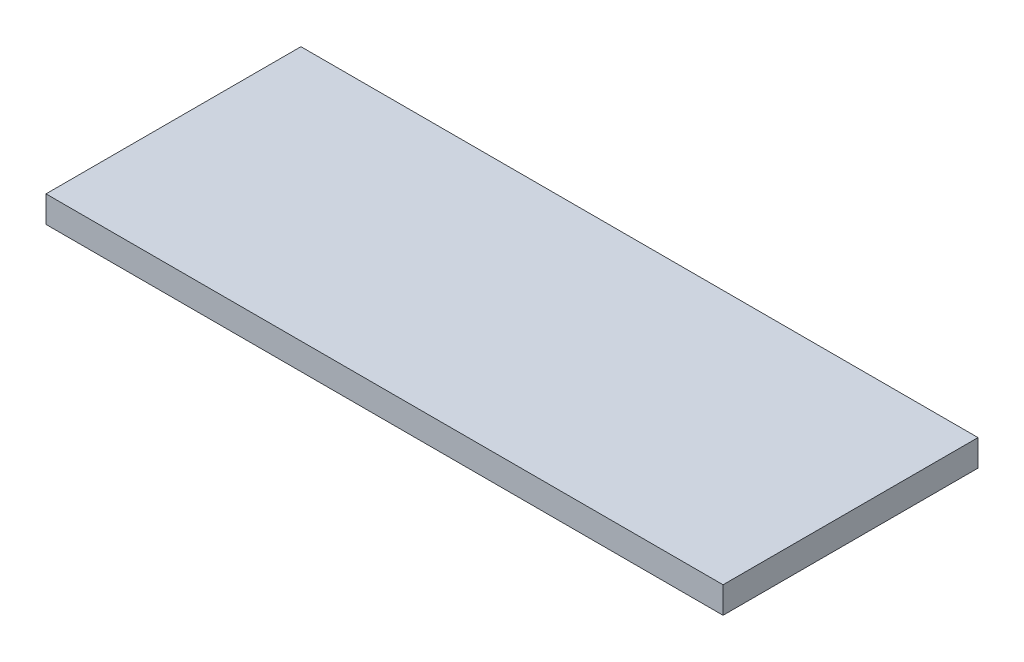
from build123d import *

# Parameters (mm, degrees)
SKETCH1_W           = 40.9
SKETCH1_H           = 15.4
BOSS_EXTRUDE1_DEPTH = 1.6


with BuildPart() as part:
    # Sketch1 → Boss-Extrude1 (new body)
    with BuildSketch(Plane(origin=(0, 0, 0), x_dir=(1, 0, 0), z_dir=(0, 1, 0))):
        Rectangle(SKETCH1_W, SKETCH1_H)
    extrude(amount=BOSS_EXTRUDE1_DEPTH)


solid = part.part
